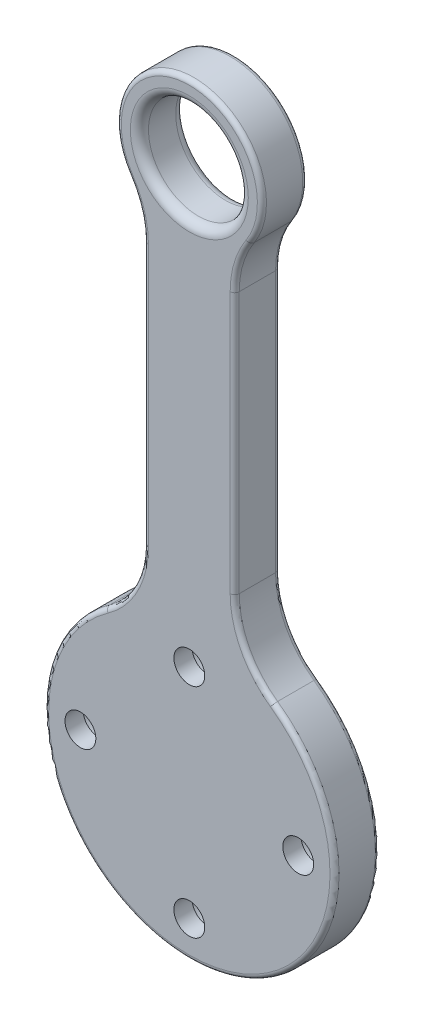
from build123d import *

# Parameters (mm, degrees)
BOSS_EXTRUDE1_DEPTH                              = 5
SKETCH8_R                                        = 16
BOSS_EXTRUDE2_DEPTH                              = 5
CBORE_FOR_M3_HEX_HEAD_MACHINE_SCREW0_D           = 3.4
CBORE_FOR_M3_HEX_HEAD_MACHINE_SCREW0_CBORE_D     = 6.5
CBORE_FOR_M3_HEX_HEAD_MACHINE_SCREW0_CBORE_DEPTH = 3
FILLET1_R                                        = 10
SKETCH7_R                                        = 5.5
CUT_EXTRUDE1_DEPTH                               = 71.03570518
FILLET2_R                                        = 1
FILLET3_R                                        = 0.5


with BuildPart() as part:
    # Sketch1 → Boss-Extrude1 (new body)
    with BuildSketch(Plane.XY.offset(5)):
        with BuildLine():
            Line((-5, 53.755002002), (-5, 13.076696831))
            ThreePointArc((-5, 13.076696831), (0, -14), (5, 13.076696831))
            Line((5, 13.076696831), (5, 53.755002002))
            ThreePointArc((5, 53.755002002), (0, 68), (-5, 53.755002002))
        make_face()
    extrude(amount=-BOSS_EXTRUDE1_DEPTH)

    # Sketch2 → Cut-Revolve1 (revolve, cut)
    with BuildSketch(Plane.XZ.offset(-60), mode=Mode.PRIVATE) as cut_revolve1_sk:
        Polygon((3.5, 5), (0, 5), (0, 0), (4.3, 0), (2.5, 1.8), (2.5, 2), (3.5, 2), align=None)
    revolve(cut_revolve1_sk.sketch.rotate(Axis((0, 60, 5), (0, 0, -1)), 180), axis=Axis((0, 60, 5), (0, 0, -1)), mode=Mode.SUBTRACT)

    # Sketch8 → Boss-Extrude2 (add)
    with BuildSketch(Plane(origin=(0, 0, 0), x_dir=(-1, 0, 0), z_dir=(0, 0, -1))):
        Circle(SKETCH8_R)
    extrude(amount=-BOSS_EXTRUDE2_DEPTH)

    # CBORE for M3 Hex Head Machine Screw0 (through all)
    with Locations(Plane(origin=(0, 0, 0), x_dir=(-1, 0, 0), z_dir=(0, 0, -1))):
        with Locations((0, 12), (12, 0), (-12, 0), (0, -12)):
            CounterBoreHole(CBORE_FOR_M3_HEX_HEAD_MACHINE_SCREW0_D / 2, CBORE_FOR_M3_HEX_HEAD_MACHINE_SCREW0_CBORE_D / 2, CBORE_FOR_M3_HEX_HEAD_MACHINE_SCREW0_CBORE_DEPTH)

    # Fillet1
    fillet1_edges = [part.edges().sort_by_distance(p)[0] for p in [
        (5, 15.198684154, 2.5),
        (-5, 15.198684154, 2.5),
        (5, 53.755002002, 2.5),
        (-5, 53.755002002, 2.5),
    ]]
    fillet(fillet1_edges, radius=FILLET1_R)

    # Sketch7 → Cut-Extrude1 (cut, through all)
    with BuildSketch(Plane(origin=(0, 0, 0), x_dir=(-1, 0, 0), z_dir=(0, 0, -1))):
        with Locations((0, 60)):
            Circle(SKETCH7_R)
    extrude(amount=-CUT_EXTRUDE1_DEPTH, mode=Mode.SUBTRACT)

    # Fillet2
    fillet2_edges = [part.edges().sort_by_distance(p)[0] for p in [
        (5.5, 60, 0),
        (5.5, 60, 5),
    ]]
    fillet(fillet2_edges, radius=FILLET2_R)

    # Fillet3
    fillet3_edges = [part.edges().sort_by_distance(p)[0] for p in [
        (0, -16, 0),
        (0, -16, 5),
        (5, 35.643443105, 0),
        (5, 35.643443105, 5),
        (-5, 35.643443105, 5),
        (-5, 35.643443105, 0),
        (0, 68, 5),
        (0, 68, 0),
        (6.120464323, 16.637429527, 5),
        (6.120464323, 16.637429527, 0),
        (-6.120464323, 16.637429527, 0),
        (-6.120464323, 16.637429527, 5),
        (-5.425728922, 52.936876975, 5),
        (-5.425728922, 52.936876975, 0),
        (5.425728922, 52.936876975, 5),
        (5.425728922, 52.936876975, 0),
    ]]
    fillet(fillet3_edges, radius=FILLET3_R)


solid = part.part
